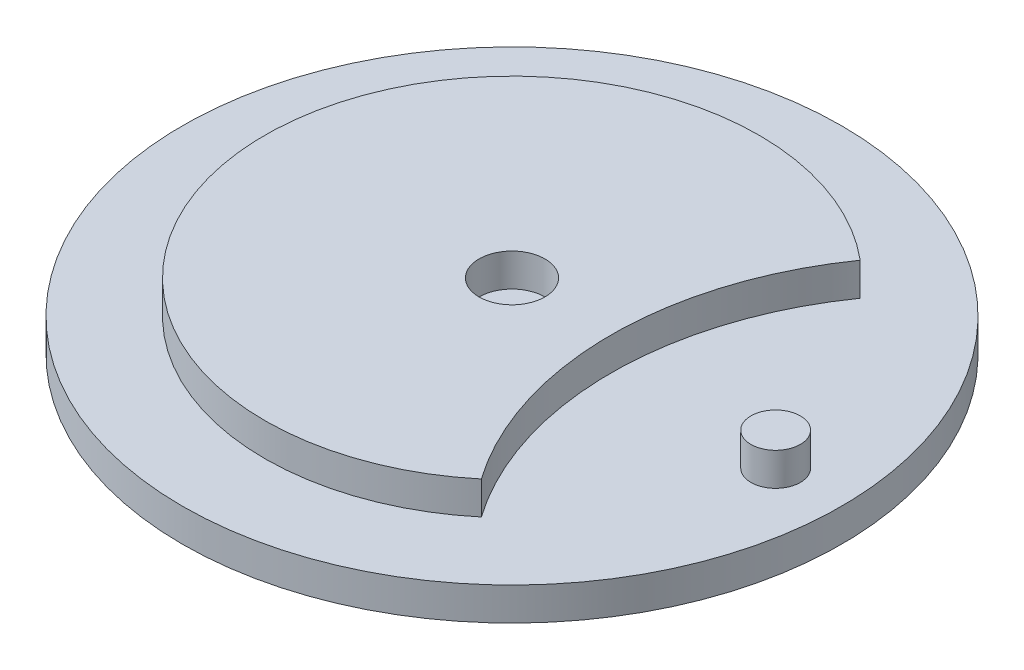
from build123d import *

# Parameters (mm, degrees)
SKETCH1_R           = 10
BOSS_EXTRUDE1_DEPTH = 10
SKETCH2_R           = 100
BOSS_EXTRUDE2_DEPTH = 10
SKETCH3_R           = 7.5
BOSS_EXTRUDE3_DEPTH = 10


with BuildPart() as part:
    # Sketch1 → Boss-Extrude1 (new body)
    with BuildSketch(Plane(origin=(0, 0, 0), x_dir=(1, 0, 0), z_dir=(0, 1, 0))):
        with BuildLine():
            ThreePointArc((48.173076923, 57.483516418), (-75, 0), (48.173076923, -57.483516418))
            ThreePointArc((48.173076923, -57.483516418), (30, 0), (48.173076923, 57.483516418))
        make_face()
        with Locations(Location((0, 0, 0), (0, 0, 270))):
            Circle(SKETCH1_R, mode=Mode.SUBTRACT)
    extrude(amount=BOSS_EXTRUDE1_DEPTH)

    # Sketch2 → Boss-Extrude2 (add)
    with BuildSketch(Plane.XZ):
        with Locations(Location((0, 0, 0), (0, 0, 270))):
            Circle(SKETCH2_R)
    extrude(amount=BOSS_EXTRUDE2_DEPTH)

    # Sketch3 → Boss-Extrude3 (add)
    with BuildSketch(Plane(origin=(0, 0, 0), x_dir=(1, 0, 0), z_dir=(0, 1, 0))):
        with Locations(Location((80, 0, 0), (0, 0, 90))):
            Circle(SKETCH3_R)
    extrude(amount=BOSS_EXTRUDE3_DEPTH)


solid = part.part
